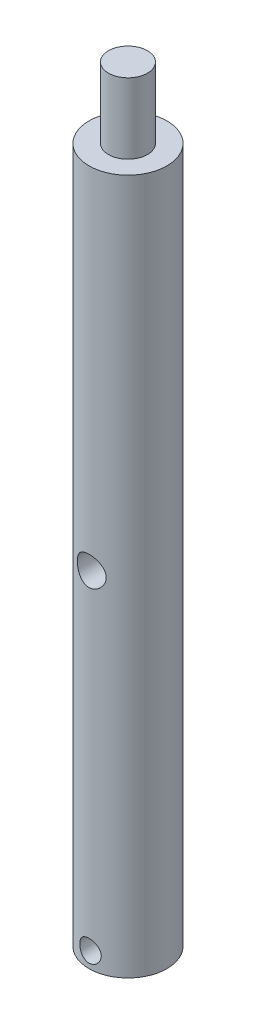
from build123d import *

# Parameters (mm, degrees)
SKETCH1_R           = 6.35
BOSS_EXTRUDE1_DEPTH = 62.3951
SKETCH3_OUTSIDE_W   = 39.916
SKETCH3_OUTSIDE_H   = 39.916
SKETCH3_OUTSIDE_R   = 3.175
CUT_EXTRUDE1_DEPTH  = 11.4935
SKETCH7_R           = 1.7526
CUT_EXTRUDE3_DEPTH  = 9.525
SKETCH10_R          = 2.3495
CUT_EXTRUDE6_DEPTH  = 6.35


with BuildPart() as part:
    # Sketch1 → Boss-Extrude1 (new, symmetric)
    with BuildSketch(Plane(origin=(0, 0, 0), x_dir=(1, 0, 0), z_dir=(0, 1, 0))):
        with Locations(Location((0, 0, 0), (0, 0, 270))):
            Circle(SKETCH1_R)
    extrude(amount=BOSS_EXTRUDE1_DEPTH, both=True)

    # Sketch3 outside → Cut-Extrude1 (cut)
    with BuildSketch(Plane(origin=(0, 62.3951, 0), x_dir=(1, 0, 0), z_dir=(0, 1, 0))):
        Rectangle(SKETCH3_OUTSIDE_W, SKETCH3_OUTSIDE_H)
        with Locations(Location((0, 0, 0), (0, 0, 270))):
            Circle(SKETCH3_OUTSIDE_R, mode=Mode.SUBTRACT)
    extrude(amount=-CUT_EXTRUDE1_DEPTH, mode=Mode.SUBTRACT)

    # Sketch7 → Cut-Extrude3 (cut, symmetric)
    with BuildSketch(Plane.XY):
        with Locations(Location((0, -59.8551, 0), (0, 0, 89.99999997))):
            Circle(SKETCH7_R)
    extrude(amount=CUT_EXTRUDE3_DEPTH, both=True, mode=Mode.SUBTRACT)

    # Sketch10 → Cut-Extrude6 (cut, symmetric)
    with BuildSketch(Plane.XY):
        with Locations(Location((0, -6.2484, 0), (0, 0, 90.000000013))):
            Circle(SKETCH10_R)
    extrude(amount=CUT_EXTRUDE6_DEPTH, both=True, mode=Mode.SUBTRACT)


solid = part.part
